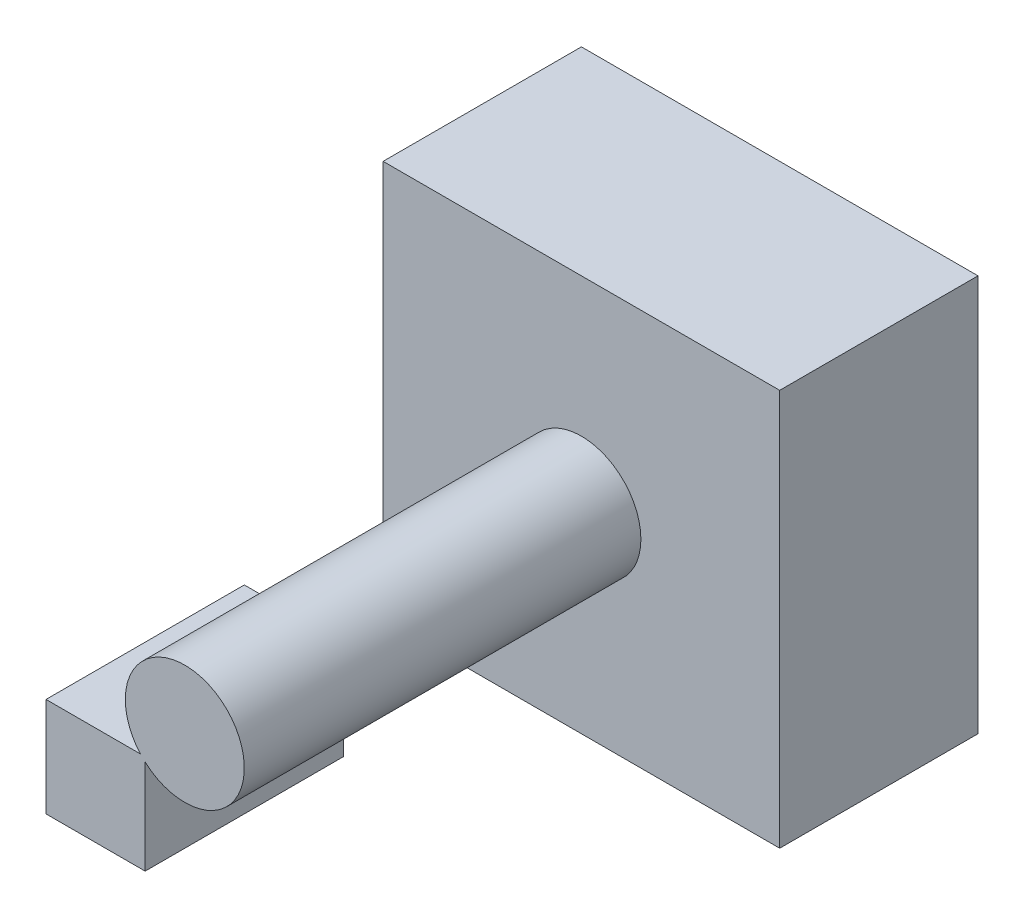
from build123d import *

# Parameters (mm, degrees)
SKETCH_1_W           = 20
SKETCH_1_H           = 20
BASEBOX_DEPTH        = 10
SKETCH_2_W           = 5
SKETCH_2_H           = 5
TARGETBOX_DEPTH      = 10
SKETCH_3_R           = 3
UPTOVERTEXBOSS_DEPTH = 20


with BuildPart() as part:
    # 草图1 → BaseBox (new body)
    with BuildSketch(Plane.XY):
        with Locations((10, 10)):
            Rectangle(SKETCH_1_W, SKETCH_1_H)
    extrude(amount=BASEBOX_DEPTH)



with BuildPart() as body_2:
    # 草图2 → TargetBox (new body)
    with BuildSketch(Plane.XY.offset(20)):
        with Locations((5.5, 5.5)):
            Rectangle(SKETCH_2_W, SKETCH_2_H)
    extrude(amount=TARGETBOX_DEPTH)


with BuildPart() as part_1:
    add(part.part)

    add(body_2.part)  # UpToVertexBoss merges body 2
    # 草图3 → UpToVertexBoss (add)
    with BuildSketch(Plane.XY.offset(10)):
        with Locations(Location((10, 10, 0), (0, 0, 221.810314896))):
            Circle(SKETCH_3_R)
    extrude(amount=UPTOVERTEXBOSS_DEPTH)


solid = part_1.part
